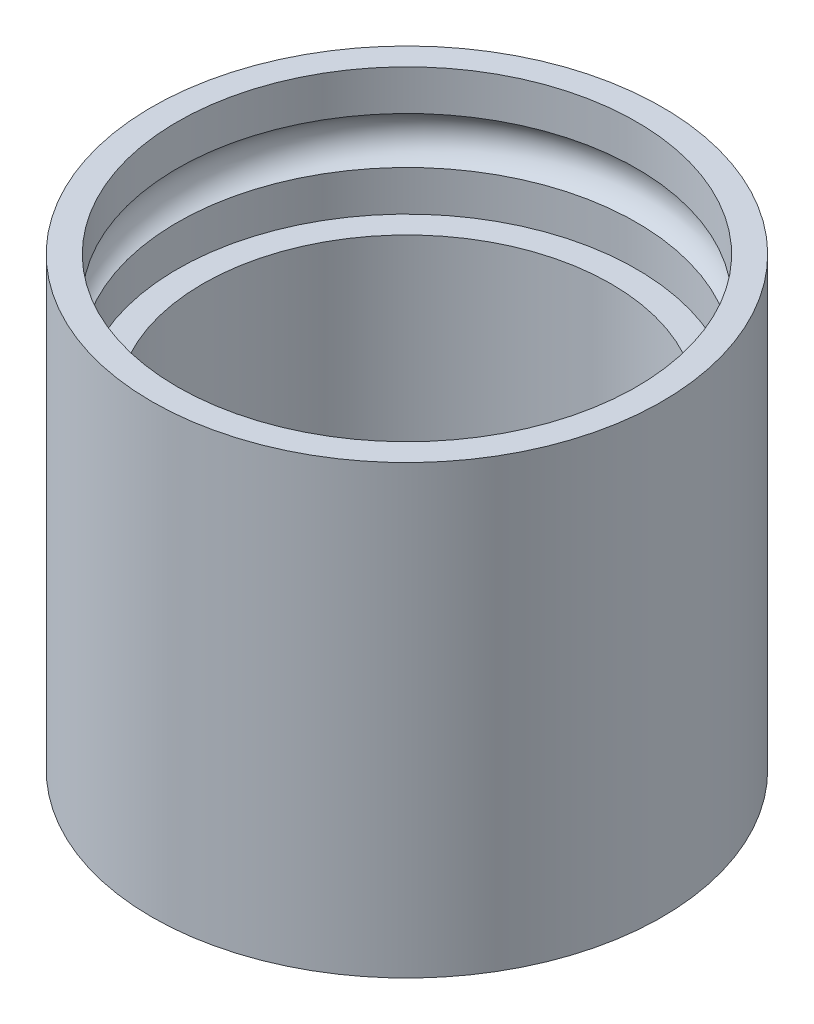
from build123d import *


with BuildPart() as part:
    # Sketch1 → Revolve1 (revolve)
    with BuildSketch(Plane(origin=(0, 0, 0), x_dir=(0, 0, -1), z_dir=(1, 0, 0))):
        with BuildLine():
            Line((0, 0), (0, -88.9))
            Line((0, -88.9), (10.16, -88.9))
            Line((10.16, -88.9), (17.78, -88.9))
            Line((17.78, -88.9), (17.78, -76.2))
            Line((17.78, -76.2), (10.16, -76.2))
            Line((10.16, -76.2), (10.16, -25.4))
            Line((10.16, -25.4), (5.08, -25.4))
            Line((5.08, -25.4), (5.08, -17.355896906))
            ThreePointArc((5.08, -17.355896906), (2.032, -12.7), (5.08, -8.044103094))
            Line((5.08, -8.044103094), (5.08, 0))
            Line((5.08, 0), (0, 0))
        make_face()
    revolve(axis=Axis((0, -28.313229254, -50.8), (0, -1, 0)))


solid = part.part
